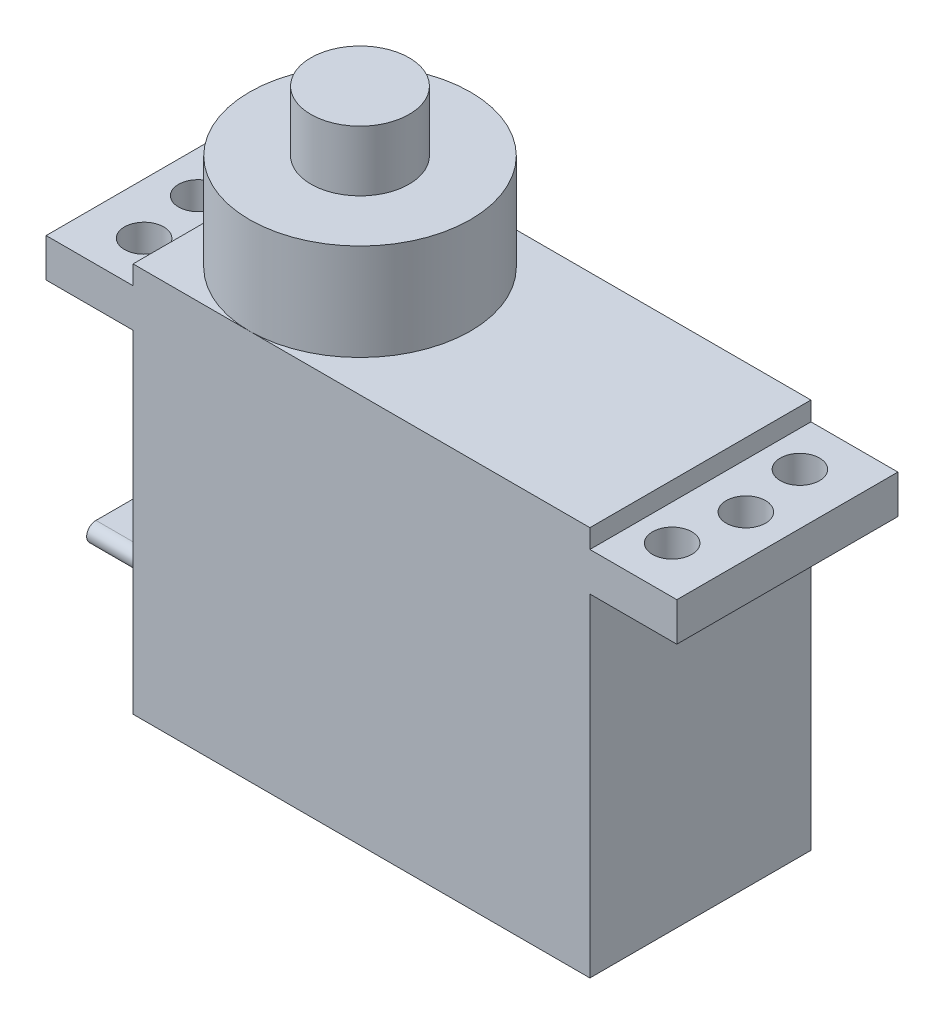
from build123d import *

# Parameters (mm, degrees)
SKETCH1_W           = 23.622
SKETCH1_H           = 20.1676
BOSS_EXTRUDE1_DEPTH = 5.715
SKETCH4_W           = 11.43
SKETCH4_H           = 1.9939
BOSS_EXTRUDE4_DEPTH = 4.4958
BOSS_EXTRUDE5_START = -0.9779
SKETCH5_R           = 5.715
BOSS_EXTRUDE5_DEPTH = 5.969
SKETCH6_R           = 2.54
BOSS_EXTRUDE6_DEPTH = 3.1242
SKETCH7_R           = 1.016
CUT_EXTRUDE1_DEPTH  = 26.822810407
SKETCH8_W           = 6.0452
SKETCH8_H           = 3.302
BOSS_EXTRUDE7_DEPTH = 1.4097
BOSS_EXTRUDE8_DEPTH = 4.572


with BuildPart() as part:
    # Sketch1 → Boss-Extrude1 (new, symmetric)
    with BuildSketch(Plane.XY):
        with Locations((0, 10.0838)):
            Rectangle(SKETCH1_W, SKETCH1_H)
    extrude(amount=BOSS_EXTRUDE1_DEPTH, both=True)

    # Sketch4 → Boss-Extrude4 (add)
    with BuildSketch(Plane.ZY.offset(11.811)):
        with Locations((0, 18.19275)):
            Rectangle(SKETCH4_W, SKETCH4_H)
    boss_extrude4 = extrude(amount=BOSS_EXTRUDE4_DEPTH)

    # Mirror1: Boss-Extrude4 across plane
    add(boss_extrude4.mirror(Plane(origin=(0, 0, 0), x_dir=(0, 0, 1), z_dir=(1, 0, 0))))

    # Sketch5 → Boss-Extrude5 (add)
    with BuildSketch(Plane(origin=(0, 20.1676, 0), x_dir=(1, 0, 0), z_dir=(0, 1, 0)).offset(BOSS_EXTRUDE5_START)):
        with Locations((-5.7912, 0)):
            Circle(SKETCH5_R)
    extrude(amount=BOSS_EXTRUDE5_DEPTH)

    # Sketch6 → Boss-Extrude6 (add)
    with BuildSketch(Plane(origin=(0, 25.1587, 0), x_dir=(1, 0, 0), z_dir=(0, 1, 0))):
        with Locations(Location((-5.7912, 0, 0), (0, 0, 180))):
            Circle(SKETCH6_R)
    extrude(amount=BOSS_EXTRUDE6_DEPTH)

    # Sketch7 → Cut-Extrude1 (cut, through all)
    with BuildSketch(Plane(origin=(0, 19.1897, 0), x_dir=(1, 0, 0), z_dir=(0, 1, 0))):
        with Locations(Location((-13.6525, 3.302, 0), (0, 0, 180))):
            Circle(SKETCH7_R)
        with Locations(Location((-13.6525, -3.302, 0), (0, 0, 180))):
            Circle(SKETCH7_R)
        with Locations(Location((-14.1605, 0, 0), (0, 0, 180))):
            Circle(SKETCH7_R)
    cut_extrude1 = extrude(amount=-CUT_EXTRUDE1_DEPTH, mode=Mode.SUBTRACT)

    # Mirror2: Cut-Extrude1 across plane
    add(cut_extrude1.mirror(Plane(origin=(0, 0, 0), x_dir=(0, 0, 1), z_dir=(1, 0, 0))), mode=Mode.SUBTRACT)

    # Sketch8 → Boss-Extrude7 (add)
    with BuildSketch(Plane.ZY.offset(11.811)):
        with Locations((0, 3.175)):
            Rectangle(SKETCH8_W, SKETCH8_H)
    extrude(amount=BOSS_EXTRUDE7_DEPTH)

    # Sketch9 → Boss-Extrude8 (add)
    with BuildSketch(Plane.ZY.offset(13.2207)):
        with BuildLine():
            Line((1.651, 2.6924), (-1.651, 2.6924))
            ThreePointArc((-1.651, 2.6924), (-2.1336, 3.175), (-1.651, 3.6576))
            Line((-1.651, 3.6576), (1.651, 3.6576))
            ThreePointArc((1.651, 3.6576), (2.1336, 3.175), (1.651, 2.6924))
        make_face()
    extrude(amount=BOSS_EXTRUDE8_DEPTH)


solid = part.part
